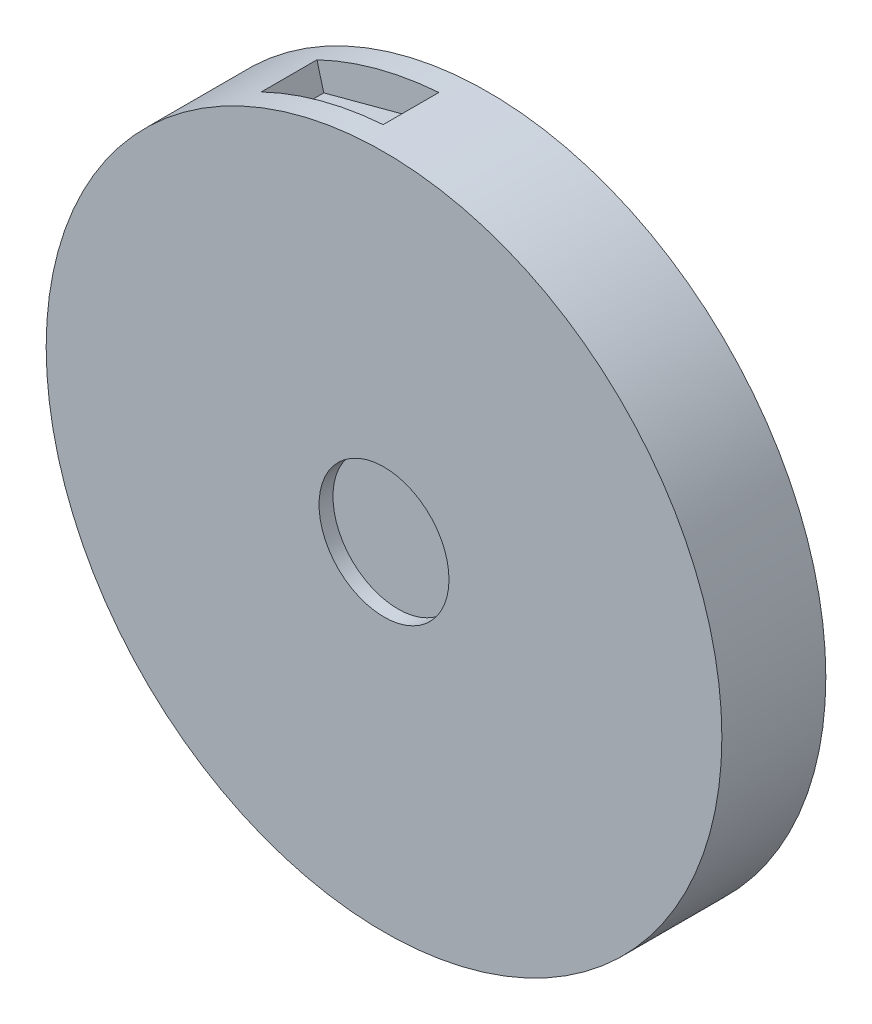
from build123d import *

# Parameters (mm, degrees)
SKETCH1_R               = 18.2
BOSS_EXTRUDE1_DEPTH     = 5.6
CUT_EXTRUDE1_DEPTH      = 4
SKETCH3_R               = 3.5
CUT_EXTRUDE2_DEPTH      = 0.75
CUT_EXTRUDE3_REACH      = 44.811
CUT_EXTRUDE3_END_RADIUS = 18.2
CUT_EXTRUDE3_START      = 16.47
SKETCH5_W               = 3
SKETCH5_H               = 6.8


with BuildPart() as part:
    # Sketch1 → Boss-Extrude1 (new body)
    with BuildSketch(Plane.XY):
        Circle(SKETCH1_R)
    extrude(amount=BOSS_EXTRUDE1_DEPTH)

    # Sketch2 → Cut-Extrude1 (cut)
    with BuildSketch(Plane(origin=(0, 0, 0), x_dir=(-1, 0, 0), z_dir=(0, 0, -1))):
        with BuildLine():
            ThreePointArc((12.962542311, -11.756806404), (13.503430209, -11.131368855), (14.014170433, -10.481079481))
            ThreePointArc((14.014170433, -10.481079481), (13.929523254, -10.546491611), (13.823271504, -10.558919696))
            ThreePointArc((13.823271504, -10.558919696), (13.129289386, -10.822950961), (13.00252715, -11.554562213))
            ThreePointArc((13.00252715, -11.554562213), (13.010601193, -11.661233209), (12.962542311, -11.756806404))
        make_face()
        with BuildLine():
            ThreePointArc((-12.406576366, -12.133139552), (-10.177222153, -12.345957703), (-9.542933233, -14.493744783))
            ThreePointArc((-9.542933233, -14.493744783), (-9.540416363, -14.622080688), (-9.460407641, -14.722455205))
            ThreePointArc((-9.460407641, -14.722455205), (-11.131368855, -13.503430209), (-12.646831358, -12.095770194))
            ThreePointArc((-12.646831358, -12.095770194), (-12.53303462, -12.155156569), (-12.406576366, -12.133139552))
        make_face()
        with BuildLine():
            ThreePointArc((12.406576366, 12.133139552), (12.53303462, 12.155156569), (12.646831358, 12.095770194))
            ThreePointArc((12.646831358, 12.095770194), (11.131368855, 13.503430209), (9.460407641, 14.722455205))
            ThreePointArc((9.460407641, 14.722455205), (9.540416363, 14.622080688), (9.542933233, 14.493744783))
            ThreePointArc((9.542933233, 14.493744783), (10.177222153, 12.345957703), (12.406576366, 12.133139552))
        make_face()
    extrude(amount=-CUT_EXTRUDE1_DEPTH, mode=Mode.SUBTRACT)

    # Sketch3 → Cut-Extrude2 (cut)
    with BuildSketch(Plane.XY.offset(5.6)):
        Circle(SKETCH3_R)
    extrude(amount=-CUT_EXTRUDE2_DEPTH, mode=Mode.SUBTRACT)

    # Cut-Extrude3: up to this cylinder (the profile starts inside it)
    cut_extrude3_end = Plane(origin=(0, 0, 2.8), z_dir=(0, 0, -1)) * Cylinder(CUT_EXTRUDE3_END_RADIUS, 127.022, mode=Mode.PRIVATE)
    # Sketch5 → Cut-Extrude3 (cut, up to the surface)
    with BuildSketch(Plane(origin=(0, 0, 0), x_dir=(0, 0, -1), z_dir=(-0.25881904510252135, 0.9659258262890681, 0)).offset(CUT_EXTRUDE3_START), mode=Mode.PRIVATE) as cut_extrude3_sk1:
        with Locations((-2.8, 0)):
            Rectangle(SKETCH5_W, SKETCH5_H)
    cut_extrude3_tool1 = extrude(cut_extrude3_sk1.sketch, amount=CUT_EXTRUDE3_REACH, mode=Mode.PRIVATE) & cut_extrude3_end
    add(cut_extrude3_tool1.solids().sort_by_distance((-4.26275, 15.908798, 2.8))[0], mode=Mode.SUBTRACT)


solid = part.part
